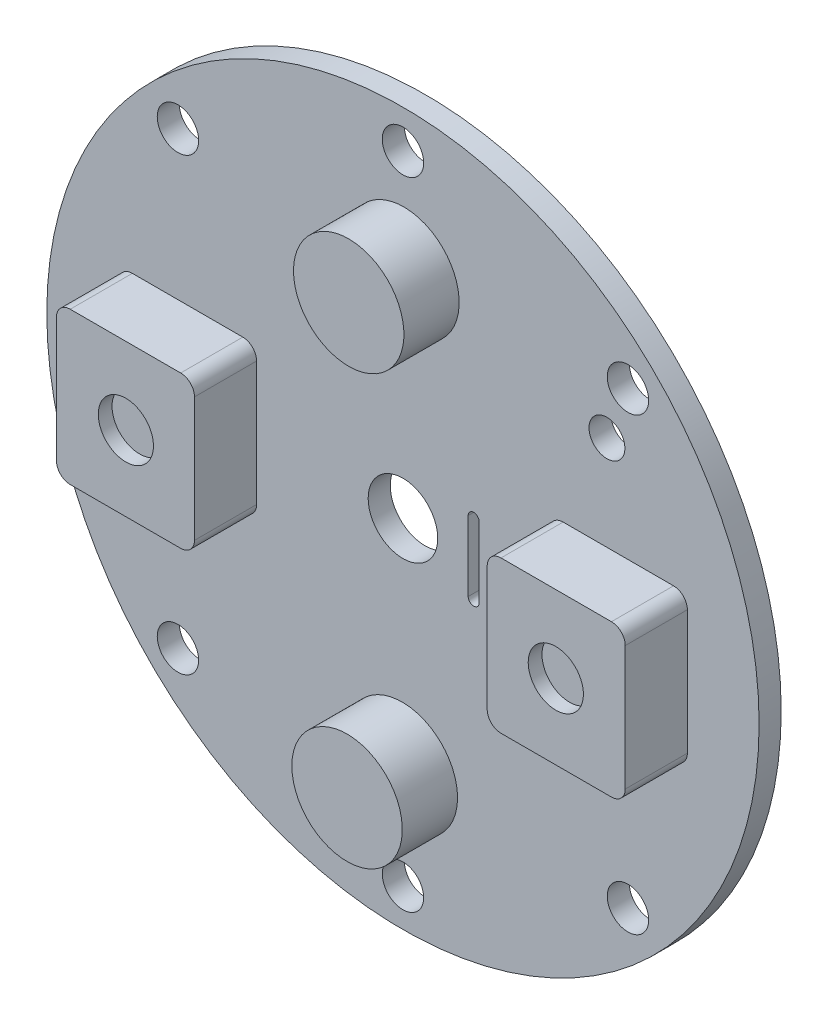
from build123d import *

# Parameters (mm, degrees)
EXTRUDE_START       = -31.200418
SKETCH_1_R          = 25.8
SKETCH_1_R_2        = 2.52
SKETCH_1_R_3        = 1.5
SKETCH_1_R_4        = 1.3
EXTRUDE_1_DEPTH     = 1.6
SKETCH_3_R          = 4
EXTRUDE_2_DEPTH     = 4
EXTRUDE_2_2_DEPTH   = 4
EXTRUDE_3_DEPTH     = 4.5
EXTRUDE_3_2_DEPTH   = 4.5
CUT_EXTRUDE_START   = -26.700418
SKETCH_5_R          = 2
CUT_EXTRUDE_1_DEPTH = 1
CUT_EXTRUDE_START_2 = -32.800418
CUT_EXTRUDE_2_DEPTH = 1.6


with BuildPart() as part:
    # 草图1 → 凸台-拉伸1 (new body)
    with BuildSketch(Plane.XY.offset(EXTRUDE_START)):
        with Locations(Location((-24.698490112, -1.512152456, 0), (0, 0, 180))):
            Circle(SKETCH_1_R)
        with Locations(Location((-24.698490112, -1.512152456, 0), (0, 0, 180))):
            Circle(SKETCH_1_R_2, mode=Mode.SUBTRACT)
        with Locations(Location((-24.698490112, 21.537847164, 0), (0, 0, 180))):
            Circle(SKETCH_1_R_3, mode=Mode.SUBTRACT)
        with Locations(Location((-40.997301149, 14.786658582, 0), (0, 0, 180))):
            Circle(SKETCH_1_R_3, mode=Mode.SUBTRACT)
        with Locations(Location((-40.997301149, -17.810963493, 0), (0, 0, 180))):
            Circle(SKETCH_1_R_3, mode=Mode.SUBTRACT)
        with Locations(Location((-24.698490112, -24.562152076, 0), (0, 0, 180))):
            Circle(SKETCH_1_R_3, mode=Mode.SUBTRACT)
        with Locations(Location((-8.399679074, -17.810963493, 0), (0, 0, 180))):
            Circle(SKETCH_1_R_3, mode=Mode.SUBTRACT)
        with Locations(Location((-8.399679074, 14.786658582, 0), (0, 0, 180))):
            Circle(SKETCH_1_R_3, mode=Mode.SUBTRACT)
        with Locations(Location((-9.921679074, 10.918658582, 0), (0, 0, 180))):
            Circle(SKETCH_1_R_4, mode=Mode.SUBTRACT)
    extrude(amount=-EXTRUDE_1_DEPTH)

    # 草图6 → 切除-拉伸2 (cut)
    with BuildSketch(Plane.XY.offset(CUT_EXTRUDE_START_2)):
        with BuildLine():
            Line((-19.174590627, 1.027847544), (-19.174590627, -4.052152456))
            ThreePointArc((-19.174590627, -4.052152456), (-19.574590627, -4.452152456), (-19.974590627, -4.052152456))
            Line((-19.974590627, -4.052152456), (-19.974590627, 1.027847544))
            ThreePointArc((-19.974590627, 1.027847544), (-19.574590627, 1.427847544), (-19.174590627, 1.027847544))
        make_face()
    extrude(amount=CUT_EXTRUDE_2_DEPTH, mode=Mode.SUBTRACT)


with BuildPart() as body_2:
    # 草图3 → 凸台-拉伸2 (new body)
    with BuildSketch(Plane.XY.offset(EXTRUDE_START)):
        with Locations(Location((-24.628347114, 14.059607135, 0), (0, 0, 180))):
            Circle(SKETCH_3_R)
    extrude(amount=EXTRUDE_2_DEPTH)


with BuildPart() as body_3:
    # 草图3 → Extrude 2 2 (new body)
    with BuildSketch(Plane.XY.offset(EXTRUDE_START)):
        with Locations(Location((-24.746304895, -17.062338322, 0), (0, 0, 180))):
            Circle(SKETCH_3_R)
    extrude(amount=EXTRUDE_2_2_DEPTH)


with BuildPart() as body_4:
    # 草图4 → 凸台-拉伸3 (new body)
    with BuildSketch(Plane.XY.offset(EXTRUDE_START)):
        with BuildLine():
            Line((-4.09665046, -1.442388212), (-4.09665046, 3.057611788))
            ThreePointArc((-4.09665046, 3.057611788), (-4.389543679, 3.764718569), (-5.09665046, 4.057611788))
            Line((-5.09665046, 4.057611788), (-13.09665046, 4.057611788))
            ThreePointArc((-13.09665046, 4.057611788), (-13.803757241, 3.764718569), (-14.09665046, 3.057611788))
            Line((-14.09665046, 3.057611788), (-14.09665046, -5.942388212))
            ThreePointArc((-14.09665046, -5.942388212), (-13.803757241, -6.649494993), (-13.09665046, -6.942388212))
            Line((-13.09665046, -6.942388212), (-5.09665046, -6.942388212))
            ThreePointArc((-5.09665046, -6.942388212), (-4.389543679, -6.649494993), (-4.09665046, -5.942388212))
            Line((-4.09665046, -5.942388212), (-4.09665046, -1.442388212))
        make_face()
    extrude(amount=EXTRUDE_3_DEPTH)


with BuildPart() as body_5:
    # 草图4 → Extrude 3 2 (new body)
    with BuildSketch(Plane.XY.offset(EXTRUDE_START)):
        with BuildLine():
            Line((-35.300329764, 3.057611788), (-35.300329764, -5.942388212))
            ThreePointArc((-35.300329764, -5.942388212), (-35.593222983, -6.649494993), (-36.300329764, -6.942388212))
            Line((-36.300329764, -6.942388212), (-44.300329764, -6.942388212))
            ThreePointArc((-44.300329764, -6.942388212), (-45.007436545, -6.649494993), (-45.300329764, -5.942388212))
            Line((-45.300329764, -5.942388212), (-45.300329764, -1.442388212))
            Line((-45.300329764, -1.442388212), (-45.300329764, 3.057611788))
            ThreePointArc((-45.300329764, 3.057611788), (-45.007436545, 3.764718569), (-44.300329764, 4.057611788))
            Line((-44.300329764, 4.057611788), (-36.300329764, 4.057611788))
            ThreePointArc((-36.300329764, 4.057611788), (-35.593222983, 3.764718569), (-35.300329764, 3.057611788))
        make_face()
    extrude(amount=EXTRUDE_3_2_DEPTH)


with BuildPart() as cut_extrude_1_tool:
    # 草图5 → 切除-拉伸1 (new body)
    with BuildSketch(Plane.XY.offset(CUT_EXTRUDE_START)):
        with Locations(Location((-9.126572542, -1.512152456, 0), (0, 0, 180))):
            Circle(SKETCH_5_R)
        with Locations(Location((-40.270407682, -1.512152456, 0), (0, 0, 180))):
            Circle(SKETCH_5_R)
    extrude(amount=-CUT_EXTRUDE_1_DEPTH)


with BuildPart() as body_4_1:
    add(body_4.part)

    # 切除-拉伸1: cut by cut_extrude_1_tool
    add(cut_extrude_1_tool.part, mode=Mode.SUBTRACT)


with BuildPart() as body_5_1:
    add(body_5.part)

    # 切除-拉伸1: cut by cut_extrude_1_tool
    add(cut_extrude_1_tool.part, mode=Mode.SUBTRACT)


solid = Compound([part.part, body_2.part, body_3.part, body_4_1.part, body_5_1.part])
